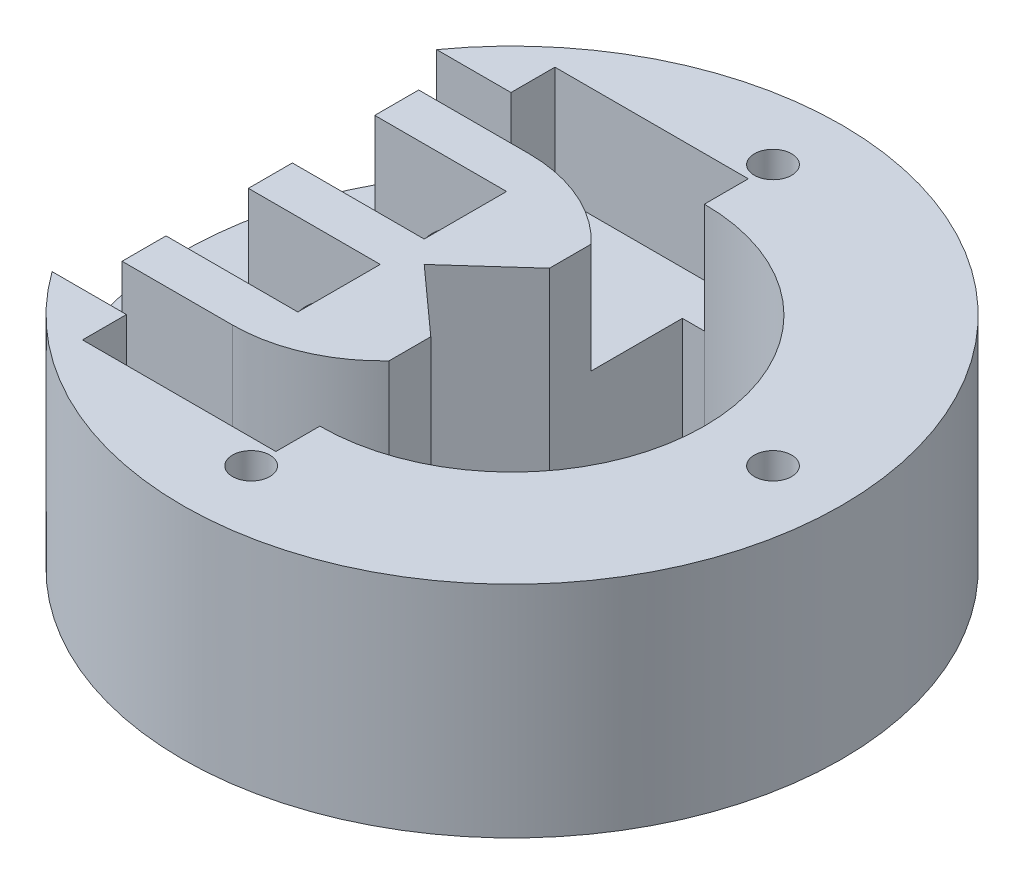
from build123d import *

# Parameters (mm, degrees)
SKETCH2_R                     = 30
BOSS_EXTRUDE1_DEPTH           = 20
CUT_EXTRUDE2_DEPTH            = 47.904157598
CUT_EXTRUDE3_START            = -10
CUT_EXTRUDE3_DEPTH            = 10
CBORE_FOR_M3_SHCS1_AT_2_COUNT = 2
CBORE_FOR_M3_SHCS1_AT_2_PITCH = 33.587572106
CBORE_FOR_M3_SHCS1_AT_3_COUNT = 2
CBORE_FOR_M3_SHCS1_AT_3_PITCH = 47.5
SKETCH6_R                     = 2.085
BOSS_EXTRUDE2_DEPTH           = 3


with BuildPart() as part:
    # Sketch2 → Boss-Extrude1 (new body)
    with BuildSketch(Plane(origin=(0, 0, 0), x_dir=(1, 0, 0), z_dir=(0, 1, 0))):
        Circle(SKETCH2_R)
    extrude(amount=BOSS_EXTRUDE1_DEPTH)

    # Sketch3 → Cut-Extrude2 (cut, through all)
    with BuildSketch(Plane(origin=(0, 20, 0), x_dir=(1, 0, 0), z_dir=(0, 1, 0))):
        with BuildLine():
            ThreePointArc((0, -17.5), (17.5, 0), (0, 17.5))
            Line((0, 17.5), (-2, 17.5))
            Line((-2, 17.5), (-2, 9.2))
            Line((-2, 9.2), (-2, 5.4))
            Line((-2, 5.4), (-8, 0))
            Line((-8, 0), (-2, -5.4))
            Line((-2, -5.4), (-2, -9.2))
            Line((-2, -9.2), (-2, -17.5))
            Line((-2, -17.5), (0, -17.5))
        make_face()
    extrude(amount=-CUT_EXTRUDE2_DEPTH, mode=Mode.SUBTRACT)

    # Sketch3<3> → Cut-Extrude3 (cut)
    with BuildSketch(Plane(origin=(0, 20, 0), x_dir=(1, 0, 0), z_dir=(0, 1, 0)).offset(CUT_EXTRUDE3_START)):
        with BuildLine():
            Line((-17.6, 17.5), (-24.366985862, 17.5))
            ThreePointArc((-24.366985862, 17.5), (-30, 0), (-24.366985862, -17.5))
            Line((-24.366985862, -17.5), (-17.6, -17.5))
            Line((-17.6, -17.5), (-17.6, -21.5))
            Line((-17.6, -21.5), (0, -21.5))
            Line((0, -21.5), (0, -17.5))
            Line((0, -17.5), (-2, -17.5))
            Line((-2, -17.5), (-2, -9.2))
            ThreePointArc((-2, -9.2), (-6.53919762, -12.379149415), (-11.966443699, -13.5))
            Line((-11.966443699, -13.5), (-22, -13.5))
            Line((-22, -13.5), (-22, -9.5))
            Line((-22, -9.5), (-10, -9.5))
            Line((-10, -9.5), (-10, -2))
            Line((-10, -2), (-22, -2))
            Line((-22, -2), (-22, 2))
            Line((-22, 2), (-10, 2))
            Line((-10, 2), (-10, 9.5))
            Line((-10, 9.5), (-22, 9.5))
            Line((-22, 9.5), (-22, 13.5))
            Line((-22, 13.5), (-11.966443699, 13.5))
            ThreePointArc((-11.966443699, 13.5), (-6.53919762, 12.379149415), (-2, 9.2))
            Line((-2, 9.2), (-2, 17.5))
            Line((-2, 17.5), (0, 17.5))
            Line((0, 17.5), (0, 21.5))
            Line((0, 21.5), (-17.6, 21.5))
            Line((-17.6, 21.5), (-17.6, 17.5))
        make_face()
    extrude(amount=CUT_EXTRUDE3_DEPTH, mode=Mode.SUBTRACT)

    # Sketch5 → CBORE for M3 SHCS1 (revolve, cut)
    with BuildSketch(Plane(origin=(0, 0, -23.75), x_dir=(0, 0, -1), z_dir=(1, 0, 0))):
        Polygon((0, 0), (0, 20), (1.7, 20), (1.7, 3), (3.25, 3), (3.25, 0.025), (3.275, 0), align=None)
    cbore_for_m3_shcs1 = revolve(axis=Axis((0, -6.35, -23.75), (0, 1, 0)), mode=Mode.SUBTRACT)

    # CBORE for M3 SHCS1 at 2: CBORE for M3 SHCS1 ×2
    with Locations(*[Vector(0.7071067811865476, 0, 0.7071067811865476) * (i * CBORE_FOR_M3_SHCS1_AT_2_PITCH) for i in range(1, CBORE_FOR_M3_SHCS1_AT_2_COUNT)]):
        add(cbore_for_m3_shcs1, mode=Mode.SUBTRACT)

    # CBORE for M3 SHCS1 at 3: CBORE for M3 SHCS1 ×2
    with Locations(*[(0, 0, i * CBORE_FOR_M3_SHCS1_AT_3_PITCH) for i in range(1, CBORE_FOR_M3_SHCS1_AT_3_COUNT)]):
        add(cbore_for_m3_shcs1, mode=Mode.SUBTRACT)

    # Sketch6 → Boss-Extrude2 (add)
    with BuildSketch(Plane.ZY.offset(10)):
        with Locations((-5.75, 15)):
            Circle(SKETCH6_R)
        with Locations((5.75, 15)):
            Circle(SKETCH6_R)
    extrude(amount=BOSS_EXTRUDE2_DEPTH)


solid = part.part
